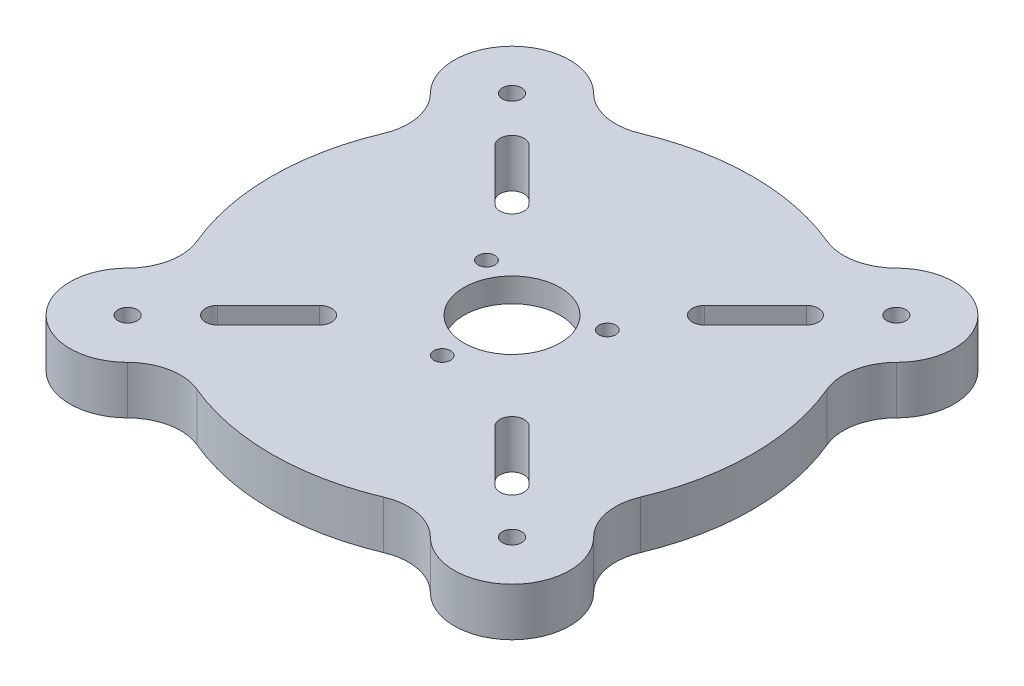
from build123d import *

# Parameters (mm, degrees)
SKETCH2_R           = 2
BOSS_EXTRUDE2_DEPTH = 10
SKETCH3_R           = 21.25
SKETCH3_R_2         = 1.75
CUT_EXTRUDE8_DEPTH  = 5
SKETCH3_9_R         = 1.75
CUT_EXTRUDE9_DEPTH  = 75.1479844
SKETCH5_R           = 10
CUT_EXTRUDE10_DEPTH = 74.640502379


with BuildPart() as part:
    # Sketch2 → Boss-Extrude2 (new body)
    with BuildSketch(Plane(origin=(0, 0, 0), x_dir=(1, 0, 0), z_dir=(0, 1, 0))):
        with BuildLine():
            ThreePointArc((46.077281732, -19.413503243), (50, 0), (46.077281732, 19.413503243))
            ThreePointArc((46.077281732, 19.413503243), (45.41900176, 25.799706685), (48.436814511, 31.466251763))
            ThreePointArc((48.436814511, 31.466251763), (48.436814511, 48.436814511), (31.466251763, 48.436814511))
            ThreePointArc((31.466251763, 48.436814511), (25.799706685, 45.41900176), (19.413503243, 46.077281732))
            ThreePointArc((19.413503243, 46.077281732), (0, 50), (-19.413503243, 46.077281732))
            ThreePointArc((-19.413503243, 46.077281732), (-25.799706685, 45.41900176), (-31.466251763, 48.436814511))
            ThreePointArc((-31.466251763, 48.436814511), (-48.436814511, 48.436814511), (-48.436814511, 31.466251763))
            ThreePointArc((-48.436814511, 31.466251763), (-45.41900176, 25.799706685), (-46.077281732, 19.413503243))
            ThreePointArc((-46.077281732, 19.413503243), (-50, 0), (-46.077281732, -19.413503243))
            ThreePointArc((-46.077281732, -19.413503243), (-45.41900176, -25.799706685), (-48.436814511, -31.466251763))
            ThreePointArc((-48.436814511, -31.466251763), (-48.436814511, -48.436814511), (-31.466251763, -48.436814511))
            ThreePointArc((-31.466251763, -48.436814511), (-25.799706685, -45.41900176), (-19.413503243, -46.077281732))
            ThreePointArc((-19.413503243, -46.077281732), (0, -50), (19.413503243, -46.077281732))
            ThreePointArc((19.413503243, -46.077281732), (25.799706685, -45.41900176), (31.466251763, -48.436814511))
            ThreePointArc((31.466251763, -48.436814511), (48.436814511, -48.436814511), (48.436814511, -31.466251763))
            ThreePointArc((48.436814511, -31.466251763), (45.41900176, -25.799706685), (46.077281732, -19.413503243))
        make_face()
        with BuildLine():
            ThreePointArc((-21.767766953, -18.232233047), (-18.232233047, -18.232233047), (-18.232233047, -21.767766953))
            Line((-18.232233047, -21.767766953), (-28.838834765, -32.374368671))
            ThreePointArc((-28.838834765, -32.374368671), (-32.374368671, -32.374368671), (-32.374368671, -28.838834765))
            Line((-32.374368671, -28.838834765), (-21.767766953, -18.232233047))
        make_face(mode=Mode.SUBTRACT)
        with BuildLine():
            ThreePointArc((18.232233047, -21.767766953), (18.232233047, -18.232233047), (21.767766953, -18.232233047))
            Line((21.767766953, -18.232233047), (32.374368671, -28.838834765))
            ThreePointArc((32.374368671, -28.838834765), (32.374368671, -32.374368671), (28.838834765, -32.374368671))
            Line((28.838834765, -32.374368671), (18.232233047, -21.767766953))
        make_face(mode=Mode.SUBTRACT)
        with BuildLine():
            ThreePointArc((-18.232233047, 21.767766953), (-18.232233047, 18.232233047), (-21.767766953, 18.232233047))
            Line((-21.767766953, 18.232233047), (-32.374368671, 28.838834765))
            ThreePointArc((-32.374368671, 28.838834765), (-32.374368671, 32.374368671), (-28.838834765, 32.374368671))
            Line((-28.838834765, 32.374368671), (-18.232233047, 21.767766953))
        make_face(mode=Mode.SUBTRACT)
        with BuildLine():
            ThreePointArc((21.767766953, 18.232233047), (18.232233047, 18.232233047), (18.232233047, 21.767766953))
            Line((18.232233047, 21.767766953), (28.838834765, 32.374368671))
            ThreePointArc((28.838834765, 32.374368671), (32.374368671, 32.374368671), (32.374368671, 28.838834765))
            Line((32.374368671, 28.838834765), (21.767766953, 18.232233047))
        make_face(mode=Mode.SUBTRACT)
        with Locations((39.951533137, -39.951533137)):
            Circle(SKETCH2_R, mode=Mode.SUBTRACT)
        with Locations((-39.951533137, -39.951533137)):
            Circle(SKETCH2_R, mode=Mode.SUBTRACT)
        with Locations((-39.951533137, 39.951533137)):
            Circle(SKETCH2_R, mode=Mode.SUBTRACT)
        with Locations((39.951533137, 39.951533137)):
            Circle(SKETCH2_R, mode=Mode.SUBTRACT)
    extrude(amount=BOSS_EXTRUDE2_DEPTH)

    # Sketch3 → Cut-Extrude8 (cut)
    with BuildSketch(Plane.XZ):
        Circle(SKETCH3_R)
        with Locations((-12.557368355, -7.25)):
            Circle(SKETCH3_R_2, mode=Mode.SUBTRACT)
        with Locations((12.557368355, -7.25)):
            Circle(SKETCH3_R_2, mode=Mode.SUBTRACT)
        with Locations((0, 14.5)):
            Circle(SKETCH3_R_2, mode=Mode.SUBTRACT)
    extrude(amount=-CUT_EXTRUDE8_DEPTH, mode=Mode.SUBTRACT)

    # Sketch3<9> → Cut-Extrude9 (cut, through all)
    with BuildSketch(Plane.XZ):
        with Locations((0, 14.5)):
            Circle(SKETCH3_9_R)
        with Locations((12.557368355, -7.25)):
            Circle(SKETCH3_9_R)
        with Locations((-12.557368355, -7.25)):
            Circle(SKETCH3_9_R)
    extrude(amount=-CUT_EXTRUDE9_DEPTH, mode=Mode.SUBTRACT)

    # Sketch5 → Cut-Extrude10 (cut, through all)
    with BuildSketch(Plane.XZ.offset(-5)):
        Circle(SKETCH5_R)
    extrude(amount=-CUT_EXTRUDE10_DEPTH, mode=Mode.SUBTRACT)


solid = part.part
